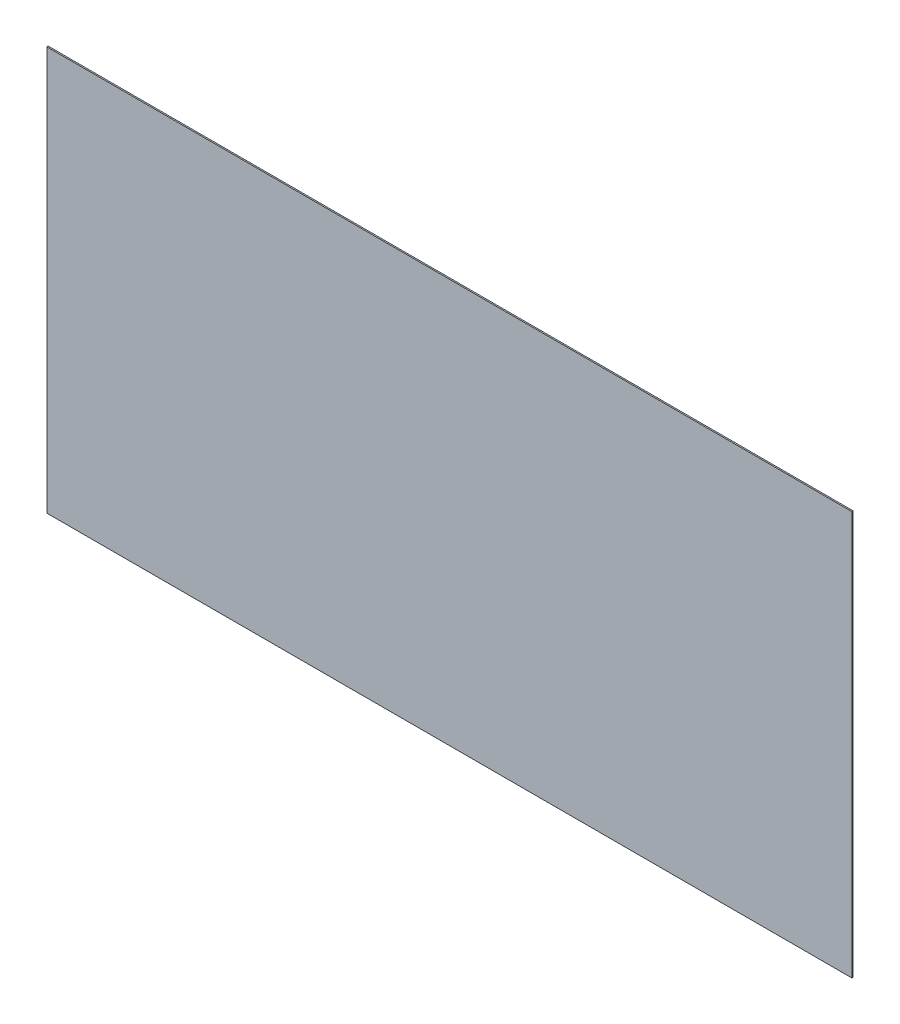
from build123d import *

# Parameters (mm, degrees)
SKETCH1_W                    = 618
SKETCH1_H                    = 310
CEK_1L_ON_IC_SAC_1_0_1_DEPTH = 1


with BuildPart() as part:
    # Sketch1 → CEK_1L_on_ic_sac_1.0_1 (new body)
    with BuildSketch(Plane.XY):
        with Locations((309, 155)):
            Rectangle(SKETCH1_W, SKETCH1_H)
    extrude(amount=CEK_1L_ON_IC_SAC_1_0_1_DEPTH)


solid = part.part
